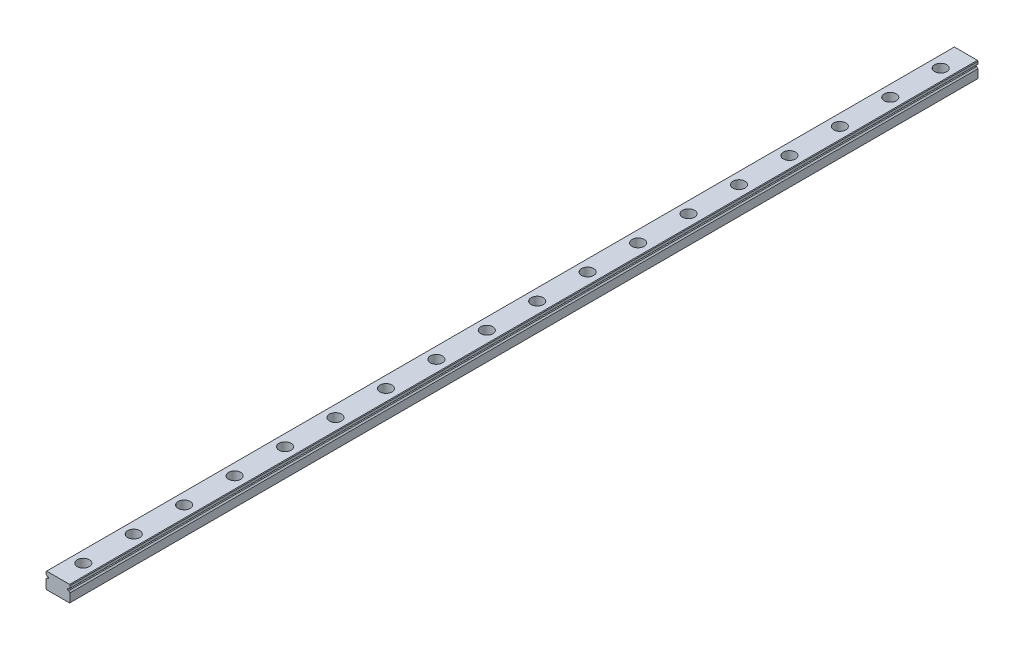
from build123d import *

# Parameters (mm, degrees)
EXTRUDE_1_DEPTH        = 450
SKETCH_2_R             = 3
SKETCH_2_R_2           = 1.75
CUT_EXTRUDE_1_DEPTH    = 4.5
SKETCH_2_2_R           = 1.75
CUT_EXTRUDE_2_DEPTH    = 451.111097397
PATTERN_LINEAR_1_COUNT = 18
PATTERN_LINEAR_1_PITCH = 25


with BuildPart() as part:
    # Эскиз1 → Бобышка-Вытянуть1 (new body)
    with BuildSketch(Plane.XY):
        with BuildLine():
            Line((-6, 3.7), (-5.7, 4))
            Line((-5.7, 4), (5.7, 4))
            Line((5.7, 4), (6, 3.7))
            Line((6, 3.7), (6, 2.451013544))
            ThreePointArc((6, 2.451013544), (5.597935912, 2.202976267), (5.354599002, 1.798050138))
            Line((5.354599002, 1.798050138), (4.643514056, 1.798050138))
            Line((4.643514056, 1.798050138), (4.643514056, 1.201949862))
            Line((4.643514056, 1.201949862), (5.354599002, 1.201949862))
            ThreePointArc((5.354599002, 1.201949862), (5.597935912, 0.797023733), (6, 0.548986456))
            Line((6, 0.548986456), (6, -3.7))
            Line((6, -3.7), (5.7, -4))
            Line((5.7, -4), (-5.7, -4))
            Line((-5.7, -4), (-6, -3.7))
            Line((-6, -3.7), (-6, 0.548986456))
            ThreePointArc((-6, 0.548986456), (-5.597935912, 0.797023733), (-5.354599002, 1.201949862))
            Line((-5.354599002, 1.201949862), (-4.643514056, 1.201949862))
            Line((-4.643514056, 1.201949862), (-4.643514056, 1.798050138))
            Line((-4.643514056, 1.798050138), (-5.354599002, 1.798050138))
            ThreePointArc((-5.354599002, 1.798050138), (-5.597935912, 2.202976267), (-6, 2.451013544))
            Line((-6, 2.451013544), (-6, 3.7))
        make_face()
    extrude(amount=EXTRUDE_1_DEPTH)

    # Эскиз2 → Вырез-Вытянуть1 (cut)
    with BuildSketch(Plane(origin=(0, 4, 0), x_dir=(1, 0, 0), z_dir=(0, 1, 0))):
        with Locations((0, -12.5)):
            Circle(SKETCH_2_R)
        with Locations((0, -12.5)):
            Circle(SKETCH_2_R_2, mode=Mode.SUBTRACT)
    cut_extrude_1 = extrude(amount=-CUT_EXTRUDE_1_DEPTH, mode=Mode.SUBTRACT)

    # Эскиз2<2> → Вырез-Вытянуть2 (cut, through all)
    with BuildSketch(Plane(origin=(0, 4, 0), x_dir=(1, 0, 0), z_dir=(0, 1, 0))):
        with Locations((0, -12.5)):
            Circle(SKETCH_2_2_R)
    cut_extrude_2 = extrude(amount=-CUT_EXTRUDE_2_DEPTH, mode=Mode.SUBTRACT)

    # Линейный массив1: Вырез-Вытянуть1, Вырез-Вытянуть2 ×18
    with Locations(*[(0, 0, i * PATTERN_LINEAR_1_PITCH) for i in range(1, PATTERN_LINEAR_1_COUNT)]):
        add(cut_extrude_1, mode=Mode.SUBTRACT)
        add(cut_extrude_2, mode=Mode.SUBTRACT)


solid = part.part
